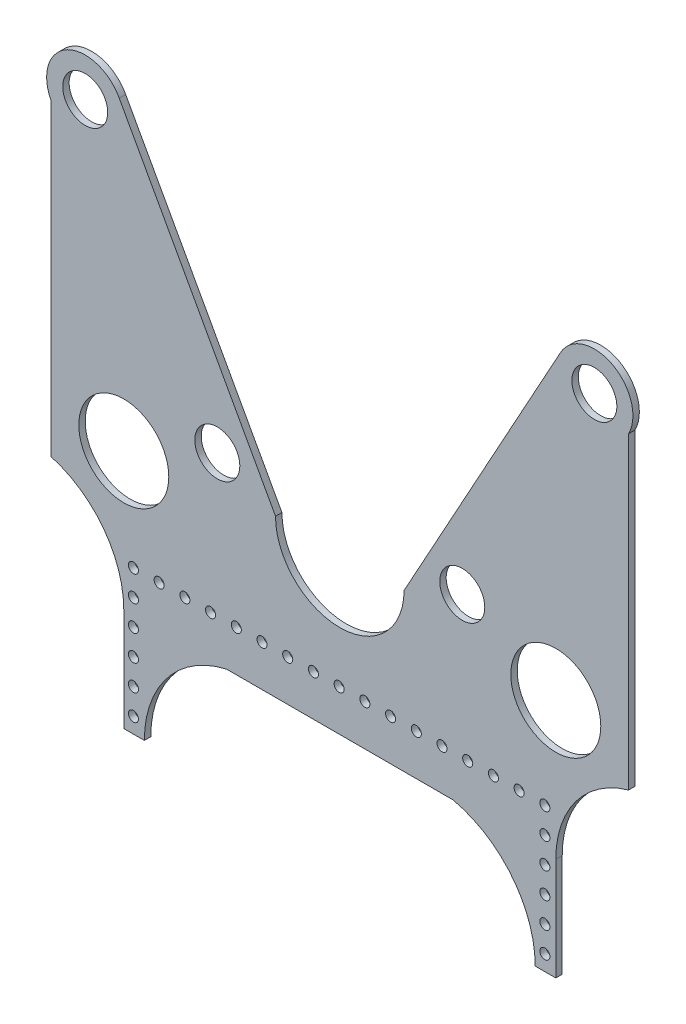
from build123d import *

# Parameters (mm, degrees)
SKETCH2_R           = 11.1125
SKETCH2_R_2         = 2.4892
SKETCH2_R_3         = 22.225
BOSS_EXTRUDE1_DEPTH = 3.175


with BuildPart() as part:
    # Sketch2 → Boss-Extrude1 (new body)
    with BuildSketch(Plane.XY):
        with BuildLine():
            Line((142.632381685, 122.462939957), (142.632381685, -29.937060043))
            ThreePointArc((142.632381685, -29.937060043), (116.6794163, -47.687448689), (106.68, -77.497587619))
            Line((106.68, -77.497587619), (106.68, -128.297587619))
            Line((106.68, -128.297587619), (96.52, -128.297587619))
            ThreePointArc((96.52, -128.297587619), (85.109838908, -95.769716492), (55.88, -77.497587619))
            Line((55.88, -77.497587619), (-55.88, -77.497587619))
            ThreePointArc((-55.88, -77.497587619), (-85.109838908, -95.769716492), (-96.52, -128.297587619))
            Line((-96.52, -128.297587619), (-106.68, -128.297587619))
            Line((-106.68, -128.297587619), (-106.68, -77.497587619))
            ThreePointArc((-106.68, -77.497587619), (-116.6794163, -47.687448689), (-142.632381685, -29.937060043))
            Line((-142.632381685, -29.937060043), (-142.632381685, 122.462939957))
            ThreePointArc((-142.632381685, 122.462939957), (-134.600001748, 148.101160684), (-108.918256202, 140.209048469))
            Line((-108.918256202, 140.209048469), (-31.75, 0))
            ThreePointArc((-31.75, 0), (0, -31.75), (31.75, 0))
            Line((31.75, 0), (108.918256202, 140.209048468))
            ThreePointArc((108.918256202, 140.209048468), (134.600001748, 148.101160684), (142.632381685, 122.462939957))
        make_face()
        with Locations((-60.484532313, 12.7)):
            Circle(SKETCH2_R, mode=Mode.SUBTRACT)
        with Locations((-125.726814921, 131.243846084)):
            Circle(SKETCH2_R, mode=Mode.SUBTRACT)
        with Locations((125.726814921, 131.243846084)):
            Circle(SKETCH2_R, mode=Mode.SUBTRACT)
        with Locations((-101.9175, -57.15)):
            Circle(SKETCH2_R_2, mode=Mode.SUBTRACT)
        with Locations((60.484532313, 12.7)):
            Circle(SKETCH2_R, mode=Mode.SUBTRACT)
        with Locations((-89.2175, -57.15)):
            Circle(SKETCH2_R_2, mode=Mode.SUBTRACT)
        with Locations((-76.5175, -57.15)):
            Circle(SKETCH2_R_2, mode=Mode.SUBTRACT)
        with Locations((-63.8175, -57.15)):
            Circle(SKETCH2_R_2, mode=Mode.SUBTRACT)
        with Locations((-51.1175, -57.15)):
            Circle(SKETCH2_R_2, mode=Mode.SUBTRACT)
        with Locations((-38.4175, -57.15)):
            Circle(SKETCH2_R_2, mode=Mode.SUBTRACT)
        with Locations((-25.7175, -57.15)):
            Circle(SKETCH2_R_2, mode=Mode.SUBTRACT)
        with Locations((-13.0175, -57.15)):
            Circle(SKETCH2_R_2, mode=Mode.SUBTRACT)
        with Locations((-0.3175, -57.15)):
            Circle(SKETCH2_R_2, mode=Mode.SUBTRACT)
        with Locations((12.3825, -57.15)):
            Circle(SKETCH2_R_2, mode=Mode.SUBTRACT)
        with Locations((25.0825, -57.15)):
            Circle(SKETCH2_R_2, mode=Mode.SUBTRACT)
        with Locations((37.7825, -57.15)):
            Circle(SKETCH2_R_2, mode=Mode.SUBTRACT)
        with Locations((50.4825, -57.15)):
            Circle(SKETCH2_R_2, mode=Mode.SUBTRACT)
        with Locations((63.1825, -57.15)):
            Circle(SKETCH2_R_2, mode=Mode.SUBTRACT)
        with Locations((75.8825, -57.15)):
            Circle(SKETCH2_R_2, mode=Mode.SUBTRACT)
        with Locations((88.5825, -57.15)):
            Circle(SKETCH2_R_2, mode=Mode.SUBTRACT)
        with Locations((101.2825, -57.15)):
            Circle(SKETCH2_R_2, mode=Mode.SUBTRACT)
        with Locations((-101.9175, -69.85)):
            Circle(SKETCH2_R_2, mode=Mode.SUBTRACT)
        with Locations((-101.9175, -82.55)):
            Circle(SKETCH2_R_2, mode=Mode.SUBTRACT)
        with Locations((-101.9175, -95.25)):
            Circle(SKETCH2_R_2, mode=Mode.SUBTRACT)
        with Locations((-101.9175, -107.95)):
            Circle(SKETCH2_R_2, mode=Mode.SUBTRACT)
        with Locations((-101.9175, -120.65)):
            Circle(SKETCH2_R_2, mode=Mode.SUBTRACT)
        with Locations((101.2825, -69.85)):
            Circle(SKETCH2_R_2, mode=Mode.SUBTRACT)
        with Locations((101.2825, -82.55)):
            Circle(SKETCH2_R_2, mode=Mode.SUBTRACT)
        with Locations((101.2825, -95.25)):
            Circle(SKETCH2_R_2, mode=Mode.SUBTRACT)
        with Locations((101.2825, -107.95)):
            Circle(SKETCH2_R_2, mode=Mode.SUBTRACT)
        with Locations((101.2825, -120.65)):
            Circle(SKETCH2_R_2, mode=Mode.SUBTRACT)
        with Locations((-106.68, -9.525)):
            Circle(SKETCH2_R_3, mode=Mode.SUBTRACT)
        with Locations((106.68, -9.525)):
            Circle(SKETCH2_R_3, mode=Mode.SUBTRACT)
    extrude(amount=BOSS_EXTRUDE1_DEPTH)


solid = part.part
